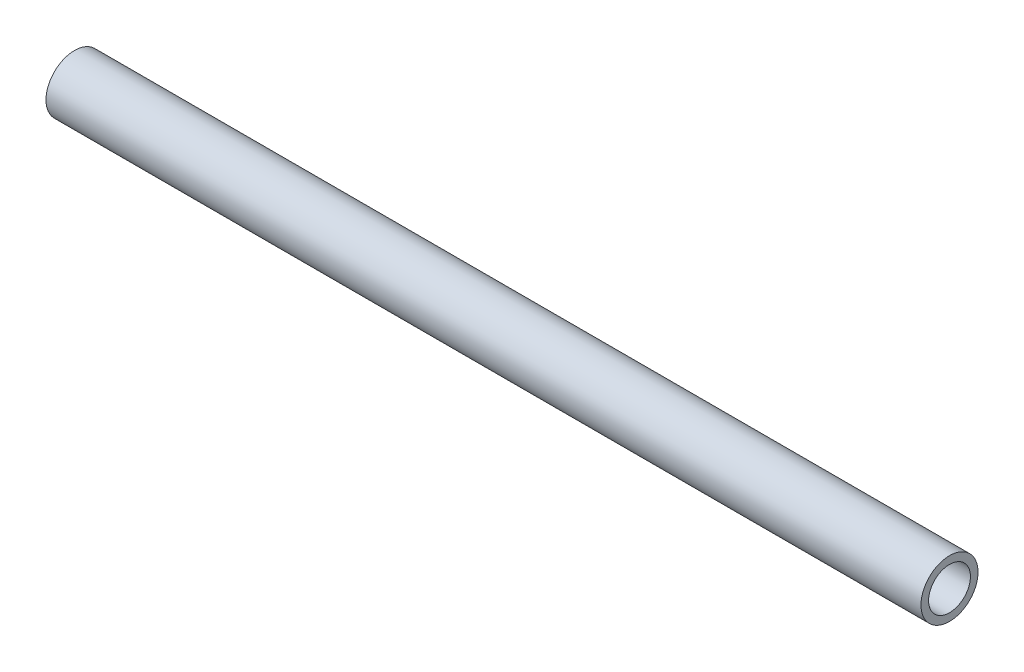
from build123d import *

# Parameters (mm, degrees)
AXIAL_PROFILE_MM_W = 69
AXIAL_PROFILE_MM_H = 0.6


with BuildPart() as part:
    # Axial profile (mm) → Full revolution (revolve)
    with BuildSketch(Plane.XY, mode=Mode.PRIVATE) as full_revolution_sk:
        with Locations((84.2, 1.95)):
            Rectangle(AXIAL_PROFILE_MM_W, AXIAL_PROFILE_MM_H)
    revolve(full_revolution_sk.sketch.rotate(Axis((-110, 0, 0), (1, 0, 0)), 90), axis=Axis((-110, 0, 0), (1, 0, 0)))


solid = part.part
